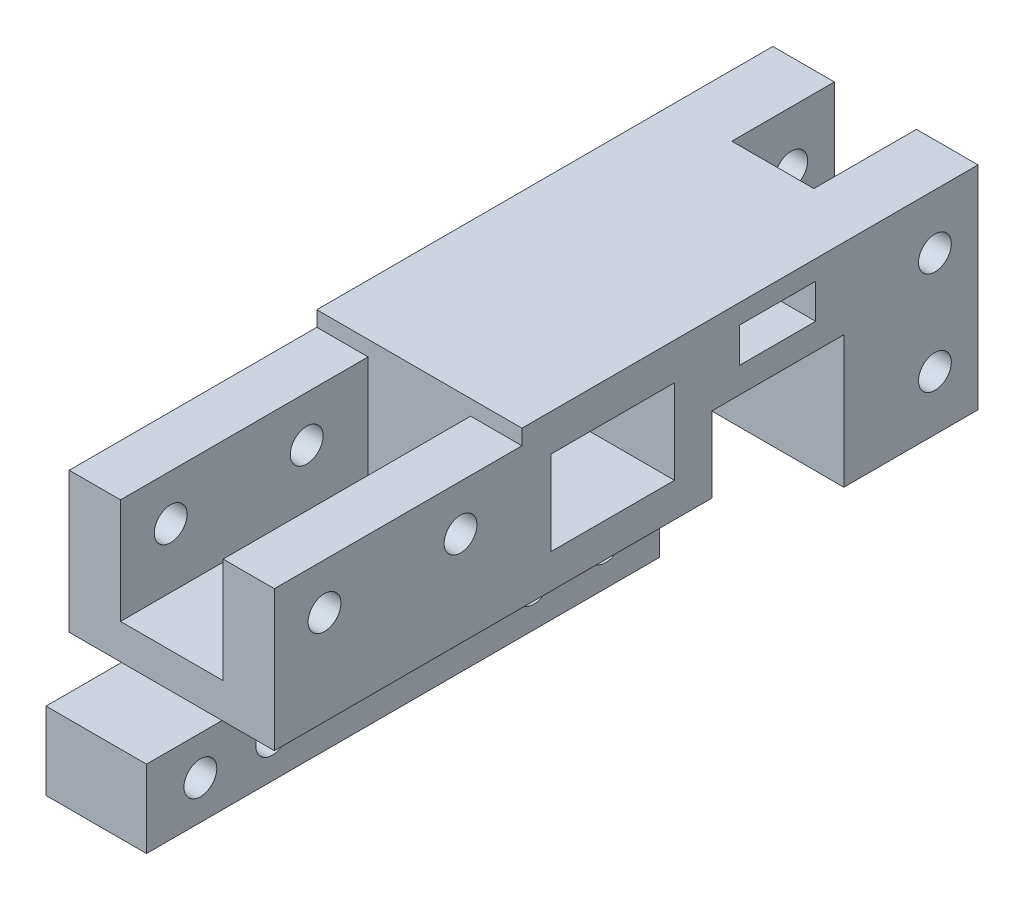
from build123d import *

# Parameters (mm, degrees)
SKETCH_2_W          = 50
SKETCH_2_H          = 7.55
SKETCH_2_R          = 1.6
EXTRUDE_1_DEPTH     = 4.9
SKETCH_3_W          = 24.132891974
SKETCH_3_H          = 13.680093874
SKETCH_3_R          = 1.6
EXTRUDE_2_DEPTH     = 10
SKETCH_4_W          = 10
SKETCH_4_H          = 10.264550668
CUT_EXTRUDE_1_DEPTH = 48.143107127
SKETCH_6_W          = 13.076103469
SKETCH_6_H          = 20.678046372
SKETCH_6_R          = 1.6
EXTRUDE_4_DEPTH     = 10
SKETCH_7_W          = 8
SKETCH_7_H          = 20.678046372
CUT_EXTRUDE_2_DEPTH = 10
EXTRUDE_5_DEPTH     = 10
SKETCH_9_W          = 12.029023446
SKETCH_9_H          = 8.2346335
SKETCH_9_W_2        = 7.42731649
SKETCH_9_H_2        = 3.390731441
CUT_EXTRUDE_3_DEPTH = 76.878053489


with BuildPart() as part:
    # 草图2 → 凸台-拉伸1 (new, symmetric)
    with BuildSketch(Plane(origin=(0, 0, 0), x_dir=(0, 0, -1), z_dir=(1, 0, 0))):
        with Locations((19.75, 0)):
            Rectangle(SKETCH_2_W, SKETCH_2_H)
        Circle(SKETCH_2_R, mode=Mode.SUBTRACT)
        with Locations((7, 0)):
            Circle(SKETCH_2_R, mode=Mode.SUBTRACT)
        with Locations((32.5, 0)):
            Circle(SKETCH_2_R, mode=Mode.SUBTRACT)
        with Locations((39.5, 0)):
            Circle(SKETCH_2_R, mode=Mode.SUBTRACT)
    extrude(amount=EXTRUDE_1_DEPTH, both=True)

    # 草图3 → 凸台-拉伸2 (add, symmetric)
    with BuildSketch(Plane(origin=(0, 0, 0), x_dir=(0, 0, -1), z_dir=(1, 0, 0))):
        with Locations((14.180871083, 10.615046937)):
            Rectangle(SKETCH_3_W, SKETCH_3_H)
        with Locations((7, 13)):
            Circle(SKETCH_3_R, mode=Mode.SUBTRACT)
        with Locations((20.26, 13)):
            Circle(SKETCH_3_R, mode=Mode.SUBTRACT)
    extrude(amount=EXTRUDE_2_DEPTH, both=True)

    # 草图4 → 切除-拉伸1 (cut, through all)
    with BuildSketch(Plane.XY.offset(-2.114425096)):
        with Locations((0, 12.32281854)):
            Rectangle(SKETCH_4_W, SKETCH_4_H)
    extrude(amount=-CUT_EXTRUDE_1_DEPTH, mode=Mode.SUBTRACT)



with BuildPart() as body_2:
    # 草图6 → 凸台-拉伸4 (new, symmetric)
    with BuildSketch(Plane(origin=(0, 0, 0), x_dir=(0, 0, -1), z_dir=(1, 0, 0))):
        with Locations((64.164086861, 8.6)):
            Rectangle(SKETCH_6_W, SKETCH_6_H)
        with Locations((66.5, 3.6)):
            Circle(SKETCH_6_R, mode=Mode.SUBTRACT)
        with Locations((66.5, 13.6)):
            Circle(SKETCH_6_R, mode=Mode.SUBTRACT)
    extrude(amount=EXTRUDE_4_DEPTH, both=True)

    # 草图7 → 切除-拉伸2 (cut)
    with BuildSketch(Plane.XY.offset(-70.702138596)):
        with Locations((0, 8.6)):
            Rectangle(SKETCH_7_W, SKETCH_7_H)
    extrude(amount=CUT_EXTRUDE_2_DEPTH, mode=Mode.SUBTRACT)


with BuildPart() as part_1:
    add(part.part)

    add(body_2.part)  # 凸台-拉伸5 merges body 2
    # 草图8 → 凸台-拉伸5 (add, symmetric)
    with BuildSketch(Plane(origin=(0, 0, 0), x_dir=(0, 0, -1), z_dir=(1, 0, 0))):
        Polygon((57.626035127, 18.939023186), (26.24731707, 18.939023186), (26.24731707, 11.139938787), (26.24731707, 3.775), (44.75, 3.775), (44.75, 11.139938787), (57.626035127, 11.139938787), align=None)
    extrude(amount=EXTRUDE_5_DEPTH, both=True)

    # 草图9 → 切除-拉伸3 (cut, through all)
    with BuildSketch(Plane(origin=(10, 0, 0), x_dir=(0, 0, -1), z_dir=(1, 0, 0))):
        with Locations((35.100955195, 11.220670488)):
            Rectangle(SKETCH_9_W, SKETCH_9_H)
        with Locations((51.16656369, 15.337987238)):
            Rectangle(SKETCH_9_W_2, SKETCH_9_H_2)
    extrude(amount=-CUT_EXTRUDE_3_DEPTH, mode=Mode.SUBTRACT)


solid = part_1.part
